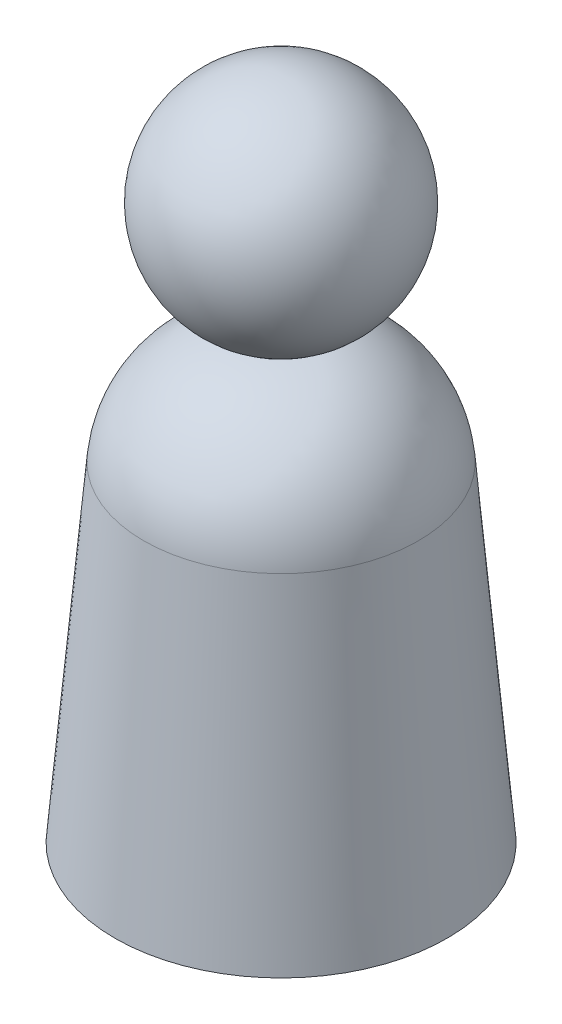
from build123d import *


with BuildPart() as part:
    # Sketch1 → Revolve1 (revolve)
    with BuildSketch(Plane(origin=(0, 0, 0), x_dir=(0, 0, -1), z_dir=(1, 0, 0))):
        with BuildLine():
            Line((0, 152.4), (0, -152.4))
            ThreePointArc((0, -152.4), (152.4, 0), (0, 152.4))
        make_face()
    revolve(axis=Axis((0, 152.4, 0), (0, -1, 0)))

    # Sketch2 → Revolve2 (revolve)
    with BuildSketch(Plane(origin=(0, 0, 0), x_dir=(0, 0, -1), z_dir=(1, 0, 0)), mode=Mode.PRIVATE) as revolve2_sk:
        with BuildLine():
            Line((0, -152.4), (0, -762))
            Line((0, -762), (228.6, -762))
            Line((228.6, -762), (188.915139057, -308.399963799))
            ThreePointArc((188.915139057, -308.399963799), (130.364902046, -193.744836471), (8.52590968, -152.161325126))
            ThreePointArc((8.52590968, -152.161325126), (4.264624883, -152.340319596), (0, -152.4))
        make_face()
    revolve(revolve2_sk.sketch.rotate(Axis((0, -152.4, 0), (0, -1, 0)), 180), axis=Axis((0, -152.4, 0), (0, -1, 0)))


solid = part.part
